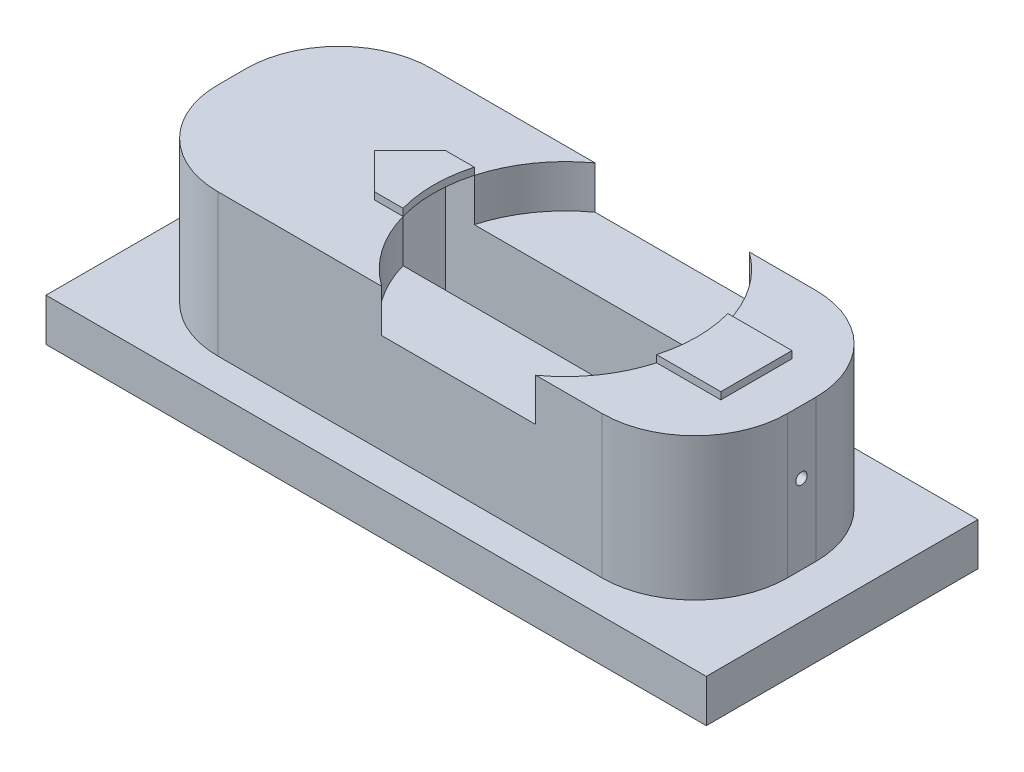
from build123d import *

# Parameters (mm, degrees)
SKETCH1_W               = 80
SKETCH1_H               = 30
BOSS_EXTRUDE1_DEPTH     = 60
CUT_EXTRUDE1_DEPTH      = 75
CUT_EXTRUDE2_DEPTH      = 102.118742081
CUT_EXTRUDE2_DEPTH_BACK = 102.118742081
SKETCH3_R               = 0.8
FILLET1_R               = 13
SKETCH15_W              = 83.696095513
SKETCH15_H              = 31.69844841
CUT_EXTRUDE7_DEPTH      = 50
SKETCH16_W              = 92.769089126
SKETCH16_H              = 38.173794917
BOSS_EXTRUDE4_DEPTH     = 6
SKETCH18_R              = 18.5
CUT_EXTRUDE8_DEPTH      = 6
BOSS_EXTRUDE5_DEPTH     = 1
BOSS_EXTRUDE5_2_DEPTH   = 1


with BuildPart() as part:
    # Sketch1 → Boss-Extrude1 (new body)
    with BuildSketch(Plane(origin=(0, 0, 0), x_dir=(1, 0, 0), z_dir=(0, 1, 0))):
        Rectangle(SKETCH1_W, SKETCH1_H)
    extrude(amount=BOSS_EXTRUDE1_DEPTH)

    # Sketch2 → Cut-Extrude1 (cut)
    with BuildSketch(Plane(origin=(0, 60, 0), x_dir=(1, 0, 0), z_dir=(0, 1, 0))):
        Polygon((-15, 5), (15, 5), (33.657016573, 5), (33.657016573, -5), (15, -5), (-15, -5), (-20, 0), align=None)
    extrude(amount=-CUT_EXTRUDE1_DEPTH, mode=Mode.SUBTRACT)

    # Sketch3 → Cut-Extrude2 (cut, two sides: drawn at the far end of the back side and taken through both)
    with BuildSketch(Plane.ZY.offset(40).offset(-CUT_EXTRUDE2_DEPTH_BACK)):
        with Locations(Location((0, 51.111959895, 0), (0, 0, 270))):
            Circle(SKETCH3_R)
    extrude(amount=CUT_EXTRUDE2_DEPTH + CUT_EXTRUDE2_DEPTH_BACK, mode=Mode.SUBTRACT)

    # Fillet1
    fillet1_edges = [part.edges().sort_by_distance(p)[0] for p in [
        (40, 30, 15),
        (-40, 30, 15),
        (-40, 30, -15),
        (40, 30, -15),
    ]]
    fillet(fillet1_edges, radius=FILLET1_R)

    # Sketch15 → Cut-Extrude7 (cut)
    with BuildSketch(Plane(origin=(0, -10, 0), x_dir=(-1, 0, 0), z_dir=(0, -1, 0))):
        with Locations((-0.057440767, 0.030479277)):
            Rectangle(SKETCH15_W, SKETCH15_H)
    extrude(amount=-CUT_EXTRUDE7_DEPTH, mode=Mode.SUBTRACT)

    # Sketch16 → Boss-Extrude4 (add)
    with BuildSketch(Plane(origin=(0, 40, 0), x_dir=(-1, 0, 0), z_dir=(0, -1, 0))):
        with Locations((0.103396131, -0.575928298)):
            Rectangle(SKETCH16_W, SKETCH16_H)
    extrude(amount=BOSS_EXTRUDE4_DEPTH)

    # Sketch18 → Cut-Extrude8 (cut)
    with BuildSketch(Plane(origin=(0, 60, 0), x_dir=(1, 0, 0), z_dir=(0, 1, 0))):
        with Locations((6.828508286, 0)):
            Circle(SKETCH18_R)
    extrude(amount=-CUT_EXTRUDE8_DEPTH, mode=Mode.SUBTRACT)


with BuildPart() as body_2:
    # Sketch19 → Boss-Extrude5 (new body)
    with BuildSketch(Plane(origin=(0, 60, 0), x_dir=(1, 0, 0), z_dir=(0, 1, 0))):
        with BuildLine():
            Line((-10.983004844, 5), (-15, 5))
            Line((-15, 5), (-20, 0))
            Line((-20, 0), (-15, -5))
            Line((-15, -5), (-10.983004844, -5))
            ThreePointArc((-10.983004844, -5), (-11.671491714, 0), (-10.983004844, 5))
        make_face()
    extrude(amount=BOSS_EXTRUDE5_DEPTH)


with BuildPart() as body_3:
    # Sketch19 → Boss-Extrude5 2 (new body)
    with BuildSketch(Plane(origin=(0, 60, 0), x_dir=(1, 0, 0), z_dir=(0, 1, 0))):
        with BuildLine():
            Line((24.640021417, 5), (33.657016573, 5))
            Line((33.657016573, 5), (33.657016573, -5))
            Line((33.657016573, -5), (24.640021417, -5))
            ThreePointArc((24.640021417, -5), (25.328508286, 0), (24.640021417, 5))
        make_face()
    extrude(amount=BOSS_EXTRUDE5_2_DEPTH)


solid = Compound([part.part, body_2.part, body_3.part])
